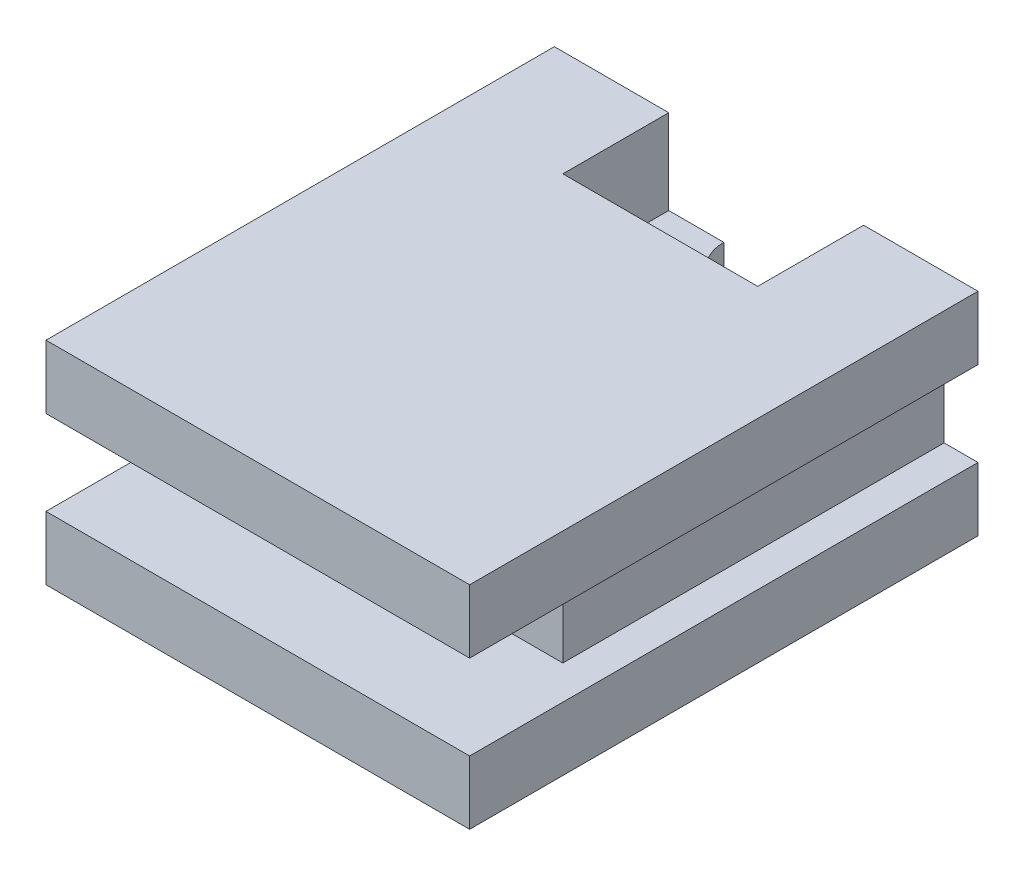
from build123d import *

# Parameters (mm, degrees)
EXTRUDE_1_DEPTH     = 60
SKETCH_2_W          = 15
SKETCH_2_H          = 10
CUT_EXTRUDE_1_DEPTH = 77.630607462
SKETCH_4_R          = 5
CUT_EXTRUDE_2_DEPTH = 70.641941386
SKETCH_5_W          = 23
SKETCH_5_H          = 25
CUT_EXTRUDE_3_DEPTH = 10


with BuildPart() as part:
    # Эскиз1 → Бобышка-Вытянуть1 (new body)
    with BuildSketch(Plane.XY):
        Polygon((-25, -5), (-25, -12.5), (25, -12.5), (25, -5), (21, -5), (21, 5), (25, 5), (25, 12.5), (-25, 12.5), (-25, 5), (-21, 5), (-21, -5), align=None)
    extrude(amount=EXTRUDE_1_DEPTH)

    # Эскиз2 → Вырез-Вытянуть1 (cut, through all)
    with BuildSketch(Plane.ZY.offset(21)):
        with Locations((52.5, 0)):
            Rectangle(SKETCH_2_W, SKETCH_2_H)
    extrude(amount=-CUT_EXTRUDE_1_DEPTH, mode=Mode.SUBTRACT)

    # Эскиз4 → Вырез-Вытянуть2 (cut, through all)
    with BuildSketch(Plane(origin=(0, 12.5, 0), x_dir=(1, 0, 0), z_dir=(0, 1, 0))):
        Circle(SKETCH_4_R)
    extrude(amount=-CUT_EXTRUDE_2_DEPTH, mode=Mode.SUBTRACT)

    # Эскиз5 → Вырез-Вытянуть3 (cut)
    with BuildSketch(Plane(origin=(0, 12.5, 0), x_dir=(1, 0, 0), z_dir=(0, 1, 0))):
        Rectangle(SKETCH_5_W, SKETCH_5_H)
    extrude(amount=-CUT_EXTRUDE_3_DEPTH, mode=Mode.SUBTRACT)


solid = part.part
